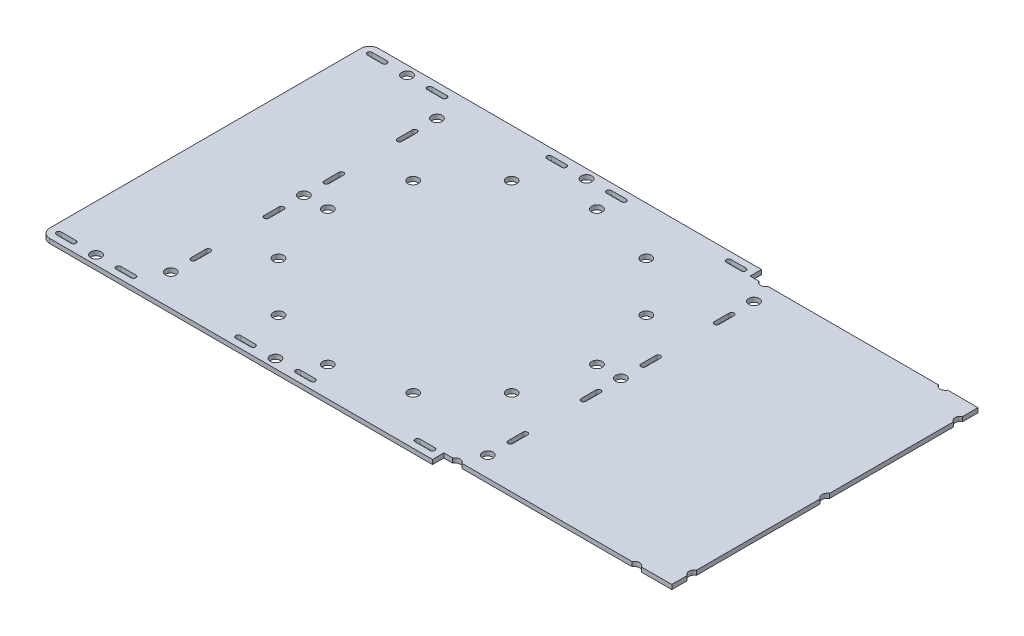
from build123d import *

# Parameters (mm, degrees)
SKETCH1_R           = 1.75
BOSS_EXTRUDE1_DEPTH = 1.5
SKETCH2_R           = 1.75
CUT_EXTRUDE1_DEPTH  = 3
FILLET1_R           = 3
SKETCH4_W           = 80
SKETCH4_H           = 3.8
CUT_EXTRUDE3_DEPTH  = 1.5
SKETCH5_W           = 3.8
SKETCH5_H           = 102.45
CUT_EXTRUDE4_DEPTH  = 1.5


with BuildPart() as part:
    # Sketch1 → Boss-Extrude1 (new body)
    with BuildSketch(Plane(origin=(0, 0, 0), x_dir=(1, 0, 0), z_dir=(0, 1, 0))):
        Polygon((0, 55), (125, 55), (125, -55), (0, -55), (-86, -55), (-86, 55), align=None)
        with Locations(Location((0, 45, 0), (0, 0, 270))):
            Circle(SKETCH1_R, mode=Mode.SUBTRACT)
        with Locations(Location((22.5, 38.97114317, 0), (0, 0, 270))):
            Circle(SKETCH1_R, mode=Mode.SUBTRACT)
        with Locations(Location((38.97114317, 22.5, 0), (0, 0, 270))):
            Circle(SKETCH1_R, mode=Mode.SUBTRACT)
        with Locations(Location((45, 0, 0), (0, 0, 270))):
            Circle(SKETCH1_R, mode=Mode.SUBTRACT)
        with Locations(Location((38.97114317, -22.5, 0), (0, 0, 270))):
            Circle(SKETCH1_R, mode=Mode.SUBTRACT)
        with Locations(Location((22.5, -38.97114317, 0), (0, 0, 270))):
            Circle(SKETCH1_R, mode=Mode.SUBTRACT)
        with Locations(Location((0, -45, 0), (0, 0, 270))):
            Circle(SKETCH1_R, mode=Mode.SUBTRACT)
        with Locations(Location((-22.5, -38.97114317, 0), (0, 0, 270))):
            Circle(SKETCH1_R, mode=Mode.SUBTRACT)
        with Locations(Location((-38.97114317, -22.5, 0), (0, 0, 270))):
            Circle(SKETCH1_R, mode=Mode.SUBTRACT)
        with Locations(Location((-45, 0, 0), (0, 0, 270))):
            Circle(SKETCH1_R, mode=Mode.SUBTRACT)
        with Locations(Location((-38.97114317, 22.5, 0), (0, 0, 270))):
            Circle(SKETCH1_R, mode=Mode.SUBTRACT)
        with Locations(Location((-22.5, 38.97114317, 0), (0, 0, 270))):
            Circle(SKETCH1_R, mode=Mode.SUBTRACT)
    extrude(amount=BOSS_EXTRUDE1_DEPTH)

    # Sketch2 → Cut-Extrude1 (cut)
    with BuildSketch(Plane(origin=(0, 1.5, 0), x_dir=(1, 0, 0), z_dir=(0, 1, 0))):
        with Locations(Location((-10.5, -52, 0), (0, 0, 270))):
            Circle(SKETCH2_R)
        with Locations(Location((49.5, -52, 0), (0, 0, 270))):
            Circle(SKETCH2_R)
        with Locations(Location((109.5, -52, 0), (0, 0, 270))):
            Circle(SKETCH2_R)
        with Locations(Location((-70.5, -52, 0), (0, 0, 270))):
            Circle(SKETCH2_R)
        with Locations(Location((122, -44.5, 0), (0, 0, 270))):
            Circle(SKETCH2_R)
        with Locations(Location((122, 0, 0), (0, 0, 270))):
            Circle(SKETCH2_R)
        with Locations(Location((53, 0, 0), (0, 0, 90))):
            Circle(SKETCH2_R)
        with Locations(Location((53, -44.5, 0), (0, 0, 90))):
            Circle(SKETCH2_R)
        with Locations(Location((-53, -44.5, 0), (0, 0, 270))):
            Circle(SKETCH2_R)
        with Locations(Location((-53, 0, 0), (0, 0, 270))):
            Circle(SKETCH2_R)
        with BuildLine():
            Line((-83, -51.2), (-78, -51.2))
            ThreePointArc((-78, -51.2), (-77.2, -52), (-78, -52.8))
            Line((-78, -52.8), (-83, -52.8))
            ThreePointArc((-83, -52.8), (-83.8, -52), (-83, -51.2))
        make_face()
        with BuildLine():
            Line((-58, -51.2), (-63, -51.2))
            ThreePointArc((-63, -51.2), (-63.8, -52), (-63, -52.8))
            Line((-63, -52.8), (-58, -52.8))
            ThreePointArc((-58, -52.8), (-57.2, -52), (-58, -51.2))
        make_face()
        with BuildLine():
            Line((-23, -51.2), (-18, -51.2))
            ThreePointArc((-18, -51.2), (-17.2, -52), (-18, -52.8))
            Line((-18, -52.8), (-23, -52.8))
            ThreePointArc((-23, -52.8), (-23.8, -52), (-23, -51.2))
        make_face()
        with BuildLine():
            Line((2, -51.2), (-3, -51.2))
            ThreePointArc((-3, -51.2), (-3.8, -52), (-3, -52.8))
            Line((-3, -52.8), (2, -52.8))
            ThreePointArc((2, -52.8), (2.8, -52), (2, -51.2))
        make_face()
        with BuildLine():
            Line((37, -51.2), (42, -51.2))
            ThreePointArc((42, -51.2), (42.8, -52), (42, -52.8))
            Line((42, -52.8), (37, -52.8))
            ThreePointArc((37, -52.8), (36.2, -52), (37, -51.2))
        make_face()
        with BuildLine():
            Line((62, -51.2), (57, -51.2))
            ThreePointArc((57, -51.2), (56.2, -52), (57, -52.8))
            Line((57, -52.8), (62, -52.8))
            ThreePointArc((62, -52.8), (62.8, -52), (62, -51.2))
        make_face()
        with BuildLine():
            Line((97, -51.2), (102, -51.2))
            ThreePointArc((102, -51.2), (102.8, -52), (102, -52.8))
            Line((102, -52.8), (97, -52.8))
            ThreePointArc((97, -52.8), (96.2, -52), (97, -51.2))
        make_face()
        with BuildLine():
            Line((122, -51.2), (117, -51.2))
            ThreePointArc((117, -51.2), (116.2, -52), (117, -52.8))
            Line((117, -52.8), (122, -52.8))
            ThreePointArc((122, -52.8), (122.8, -52), (122, -51.2))
        make_face()
        with BuildLine():
            Line((122.8, -7.5), (122.8, -12.5))
            ThreePointArc((122.8, -12.5), (122, -13.3), (121.2, -12.5))
            Line((121.2, -12.5), (121.2, -7.5))
            ThreePointArc((121.2, -7.5), (122, -6.7), (122.8, -7.5))
        make_face()
        with BuildLine():
            Line((122.8, -32), (122.8, -37))
            ThreePointArc((122.8, -37), (122, -37.8), (121.2, -37))
            Line((121.2, -37), (121.2, -32))
            ThreePointArc((121.2, -32), (122, -31.2), (122.8, -32))
        make_face()
        with BuildLine():
            Line((52.2, -32), (52.2, -37))
            ThreePointArc((52.2, -37), (53, -37.8), (53.8, -37))
            Line((53.8, -37), (53.8, -32))
            ThreePointArc((53.8, -32), (53, -31.2), (52.2, -32))
        make_face()
        with BuildLine():
            Line((52.2, -7.5), (52.2, -12.5))
            ThreePointArc((52.2, -12.5), (53, -13.3), (53.8, -12.5))
            Line((53.8, -12.5), (53.8, -7.5))
            ThreePointArc((53.8, -7.5), (53, -6.7), (52.2, -7.5))
        make_face()
        with BuildLine():
            Line((-52.2, -7.5), (-52.2, -12.5))
            ThreePointArc((-52.2, -12.5), (-53, -13.3), (-53.8, -12.5))
            Line((-53.8, -12.5), (-53.8, -7.5))
            ThreePointArc((-53.8, -7.5), (-53, -6.7), (-52.2, -7.5))
        make_face()
        with BuildLine():
            Line((-52.2, -32), (-52.2, -37))
            ThreePointArc((-52.2, -37), (-53, -37.8), (-53.8, -37))
            Line((-53.8, -37), (-53.8, -32))
            ThreePointArc((-53.8, -32), (-53, -31.2), (-52.2, -32))
        make_face()
    cut_extrude1 = extrude(amount=-CUT_EXTRUDE1_DEPTH, mode=Mode.SUBTRACT)

    # Fillet1
    fillet1_edges = [part.edges().sort_by_distance(p)[0] for p in [
        (-86, 0.75, 55),
        (-86, 0.75, -55),
        (125, 0.75, -55),
        (125, 0.75, 55),
    ]]
    fillet(fillet1_edges, radius=FILLET1_R)

    # Mirror1: Cut-Extrude1 across plane
    add(cut_extrude1.mirror(Plane.XY), mode=Mode.SUBTRACT)

    # Sketch4 → Cut-Extrude3 (cut)
    with BuildSketch(Plane(origin=(0, 1.5, 0), x_dir=(1, 0, 0), z_dir=(0, 1, 0))):
        with Locations((85, -53.1)):
            Rectangle(SKETCH4_W, SKETCH4_H)
        with Locations((85, 53.1)):
            Rectangle(SKETCH4_W, SKETCH4_H)
    extrude(amount=-CUT_EXTRUDE3_DEPTH, mode=Mode.SUBTRACT)

    # Sketch5 → Cut-Extrude4 (cut)
    with BuildSketch(Plane(origin=(0, 1.5, 0), x_dir=(1, 0, 0), z_dir=(0, 1, 0))):
        with Locations((123.1, -0.025)):
            Rectangle(SKETCH5_W, SKETCH5_H)
    extrude(amount=-CUT_EXTRUDE4_DEPTH, mode=Mode.SUBTRACT)


solid = part.part
